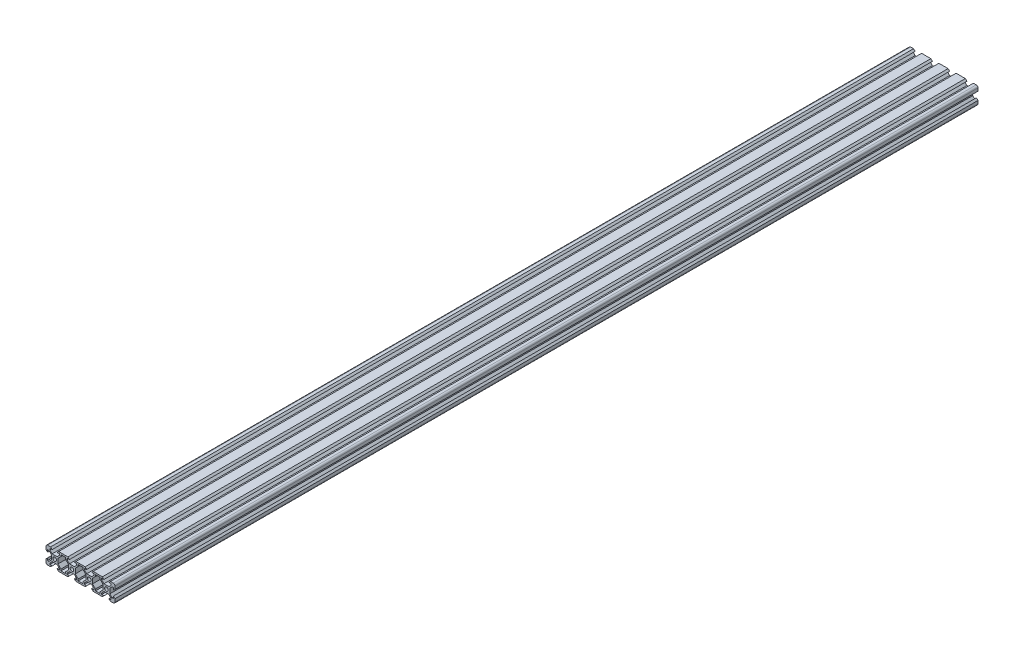
from build123d import *

# Parameters (mm, degrees)
SKETCH1_R           = 2.1
BOSS_EXTRUDE1_DEPTH = 1000


with BuildPart() as part:
    # Sketch1 → Boss-Extrude1 (new body)
    with BuildSketch(Plane(origin=(0, 0, 0), x_dir=(-1, 0, 0), z_dir=(0, 0, -1))):
        with BuildLine():
            Line((15.499339828, -8.2), (12.84, -8.2))
            Line((12.84, -8.2), (14.64, -10))
            Line((14.64, -10), (25.36, -10))
            Line((25.36, -10), (27.16, -8.2))
            Line((27.16, -8.2), (24.500660172, -8.2))
            Line((24.500660172, -8.2), (24.500660172, -6.56))
            Line((24.500660172, -6.56), (27.16, -3.900660172))
            Line((27.16, -3.900660172), (32.84, -3.900660172))
            Line((32.84, -3.900660172), (35.499339828, -6.56))
            Line((35.499339828, -6.56), (35.499339828, -8.2))
            Line((35.499339828, -8.2), (32.84, -8.2))
            Line((32.84, -8.2), (34.64, -10))
            Line((34.64, -10), (38, -10))
            ThreePointArc((38, -10), (39.414213562, -9.414213562), (40, -8))
            Line((40, -8), (40, -4.64))
            Line((40, -4.64), (38.2, -2.84))
            Line((38.2, -2.84), (38.2, -5.499339828))
            Line((38.2, -5.499339828), (36.56, -5.499339828))
            Line((36.56, -5.499339828), (33.900660172, -2.84))
            Line((33.900660172, -2.84), (33.900660172, 2.84))
            Line((33.900660172, 2.84), (36.56, 5.499339828))
            Line((36.56, 5.499339828), (38.2, 5.499339828))
            Line((38.2, 5.499339828), (38.2, 2.84))
            Line((38.2, 2.84), (40, 4.64))
            Line((40, 4.64), (40, 8))
            ThreePointArc((40, 8), (39.414213562, 9.414213562), (38, 10))
            Line((38, 10), (34.64, 10))
            Line((34.64, 10), (32.84, 8.2))
            Line((32.84, 8.2), (35.499339828, 8.2))
            Line((35.499339828, 8.2), (35.499339828, 6.56))
            Line((35.499339828, 6.56), (32.84, 3.900660172))
            Line((32.84, 3.900660172), (27.16, 3.900660172))
            Line((27.16, 3.900660172), (24.500660172, 6.56))
            Line((24.500660172, 6.56), (24.500660172, 8.2))
            Line((24.500660172, 8.2), (27.16, 8.2))
            Line((27.16, 8.2), (25.36, 10))
            Line((25.36, 10), (14.64, 10))
            Line((14.64, 10), (12.84, 8.2))
            Line((12.84, 8.2), (15.499339828, 8.2))
            Line((15.499339828, 8.2), (15.499339828, 6.56))
            Line((15.499339828, 6.56), (12.84, 3.900660172))
            Line((12.84, 3.900660172), (7.16, 3.900660172))
            Line((7.16, 3.900660172), (4.500660172, 6.56))
            Line((4.500660172, 6.56), (4.500660172, 8.2))
            Line((4.500660172, 8.2), (7.16, 8.2))
            Line((7.16, 8.2), (5.36, 10))
            Line((5.36, 10), (-5.36, 10))
            Line((-5.36, 10), (-7.16, 8.2))
            Line((-7.16, 8.2), (-4.500660172, 8.2))
            Line((-4.500660172, 8.2), (-4.500660172, 6.56))
            Line((-4.500660172, 6.56), (-7.16, 3.900660172))
            Line((-7.16, 3.900660172), (-12.84, 3.900660172))
            Line((-12.84, 3.900660172), (-15.499339828, 6.56))
            Line((-15.499339828, 6.56), (-15.499339828, 8.2))
            Line((-15.499339828, 8.2), (-12.84, 8.2))
            Line((-12.84, 8.2), (-14.64, 10))
            Line((-14.64, 10), (-25.36, 10))
            Line((-25.36, 10), (-27.16, 8.2))
            Line((-27.16, 8.2), (-24.500660172, 8.2))
            Line((-24.500660172, 8.2), (-24.500660172, 6.56))
            Line((-24.500660172, 6.56), (-27.16, 3.900660172))
            Line((-27.16, 3.900660172), (-32.84, 3.900660172))
            Line((-32.84, 3.900660172), (-35.499339828, 6.56))
            Line((-35.499339828, 6.56), (-35.499339828, 8.2))
            Line((-35.499339828, 8.2), (-32.84, 8.2))
            Line((-32.84, 8.2), (-34.64, 10))
            Line((-34.64, 10), (-38, 10))
            ThreePointArc((-38, 10), (-39.414213562, 9.414213562), (-40, 8))
            Line((-40, 8), (-40, 4.64))
            Line((-40, 4.64), (-38.2, 2.84))
            Line((-38.2, 2.84), (-38.2, 5.499339828))
            Line((-38.2, 5.499339828), (-36.56, 5.499339828))
            Line((-36.56, 5.499339828), (-33.900660172, 2.84))
            Line((-33.900660172, 2.84), (-33.900660172, -2.84))
            Line((-33.900660172, -2.84), (-36.56, -5.499339828))
            Line((-36.56, -5.499339828), (-38.2, -5.499339828))
            Line((-38.2, -5.499339828), (-38.2, -2.84))
            Line((-38.2, -2.84), (-40, -4.64))
            Line((-40, -4.64), (-40, -8))
            ThreePointArc((-40, -8), (-39.414213562, -9.414213562), (-38, -10))
            Line((-38, -10), (-34.64, -10))
            Line((-34.64, -10), (-32.84, -8.2))
            Line((-32.84, -8.2), (-35.499339828, -8.2))
            Line((-35.499339828, -8.2), (-35.499339828, -6.56))
            Line((-35.499339828, -6.56), (-32.84, -3.900660172))
            Line((-32.84, -3.900660172), (-27.16, -3.900660172))
            Line((-27.16, -3.900660172), (-24.500660172, -6.56))
            Line((-24.500660172, -6.56), (-24.500660172, -8.2))
            Line((-24.500660172, -8.2), (-27.16, -8.2))
            Line((-27.16, -8.2), (-25.36, -10))
            Line((-25.36, -10), (-14.64, -10))
            Line((-14.64, -10), (-12.84, -8.2))
            Line((-12.84, -8.2), (-15.499339828, -8.2))
            Line((-15.499339828, -8.2), (-15.499339828, -6.56))
            Line((-15.499339828, -6.56), (-12.84, -3.900660172))
            Line((-12.84, -3.900660172), (-7.16, -3.900660172))
            Line((-7.16, -3.900660172), (-4.500660172, -6.56))
            Line((-4.500660172, -6.56), (-4.500660172, -8.2))
            Line((-4.500660172, -8.2), (-7.16, -8.2))
            Line((-7.16, -8.2), (-5.36, -10))
            Line((-5.36, -10), (5.36, -10))
            Line((5.36, -10), (7.16, -8.2))
            Line((7.16, -8.2), (4.500660172, -8.2))
            Line((4.500660172, -8.2), (4.500660172, -6.56))
            Line((4.500660172, -6.56), (7.16, -3.900660172))
            Line((7.16, -3.900660172), (12.84, -3.900660172))
            Line((12.84, -3.900660172), (15.499339828, -6.56))
            Line((15.499339828, -6.56), (15.499339828, -8.2))
        make_face()
        with Locations(Location((10, 0, 0), (0, 0, 180))):
            Circle(SKETCH1_R, mode=Mode.SUBTRACT)
        with Locations(Location((30, 0, 0), (0, 0, 180))):
            Circle(SKETCH1_R, mode=Mode.SUBTRACT)
        with Locations(Location((-10, 0, 0), (0, 0, 180))):
            Circle(SKETCH1_R, mode=Mode.SUBTRACT)
        with Locations(Location((-30, 0, 0), (0, 0, 180))):
            Circle(SKETCH1_R, mode=Mode.SUBTRACT)
        Polygon((17.300660172, -6.24), (13.900660172, -2.84), (13.900660172, 2.84), (17.300660172, 6.24), (17.300660172, 8.2), (22.699339828, 8.2), (22.699339828, 6.24), (26.099339828, 2.84), (26.099339828, -2.84), (22.699339828, -6.24), (22.699339828, -8.2), (17.300660172, -8.2), align=None, mode=Mode.SUBTRACT)
        Polygon((2.699339828, 6.24), (6.099339828, 2.84), (6.099339828, -2.84), (2.699339828, -6.24), (2.699339828, -8.2), (-2.699339828, -8.2), (-2.699339828, -6.24), (-6.099339828, -2.84), (-6.099339828, 2.84), (-2.699339828, 6.24), (-2.699339828, 8.2), (2.699339828, 8.2), align=None, mode=Mode.SUBTRACT)
        Polygon((-13.900660172, -2.84), (-17.300660172, -6.24), (-17.300660172, -8.2), (-22.699339828, -8.2), (-22.699339828, -6.24), (-26.099339828, -2.84), (-26.099339828, 2.84), (-22.699339828, 6.24), (-22.699339828, 8.2), (-17.300660172, 8.2), (-17.300660172, 6.24), (-13.900660172, 2.84), align=None, mode=Mode.SUBTRACT)
    extrude(amount=-BOSS_EXTRUDE1_DEPTH)


solid = part.part
